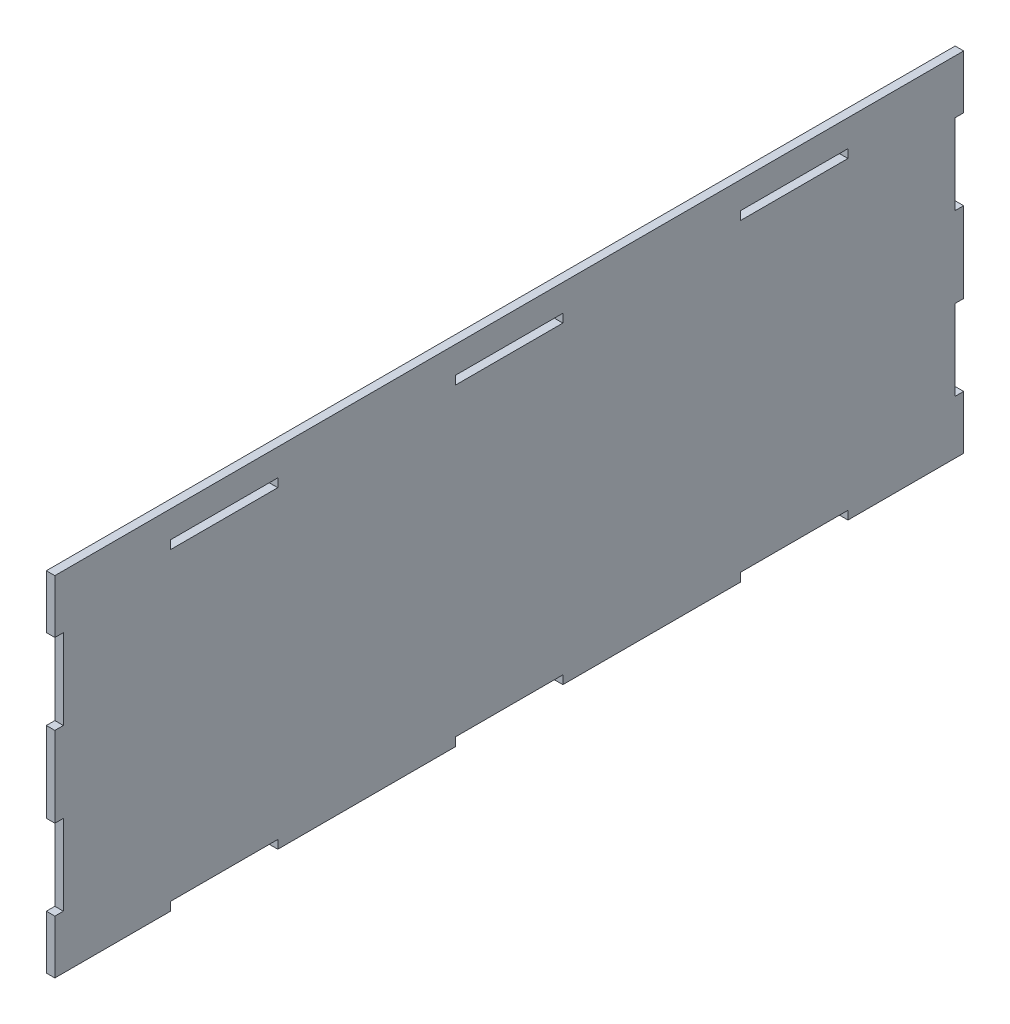
from build123d import *

# Parameters (mm, degrees)
SKETCH1_W           = 339.05
SKETCH1_H           = 130
BOSS_EXTRUDE1_DEPTH = 3.175
SKETCH2_W           = 40
SKETCH2_H           = 3.175
SKETCH2_W_2         = 3.175
SKETCH2_H_2         = 30
CUT_EXTRUDE1_DEPTH  = 10
SKETCH3_W           = 40
SKETCH3_H           = 3.175
CUT_EXTRUDE2_DEPTH  = 364.132184094
LPATTERN1_COUNT     = 3
LPATTERN1_PITCH     = 106.35


with BuildPart() as part:
    # Sketch1 → Boss-Extrude1 (new body)
    with BuildSketch(Plane(origin=(0, 0, 0), x_dir=(0, 0, -1), z_dir=(1, 0, 0))):
        with Locations((169.525, -65)):
            Rectangle(SKETCH1_W, SKETCH1_H)
    extrude(amount=BOSS_EXTRUDE1_DEPTH)

    # Sketch2 → Cut-Extrude1 (cut)
    with BuildSketch(Plane(origin=(3.175, 0, 0), x_dir=(0, 0, -1), z_dir=(1, 0, 0))):
        with Locations((63.175, -11.5875)):
            Rectangle(SKETCH2_W, SKETCH2_H)
        with Locations((169.525, -11.5875)):
            Rectangle(SKETCH2_W, SKETCH2_H)
        with Locations((275.875, -11.5875)):
            Rectangle(SKETCH2_W, SKETCH2_H)
        with Locations((337.4625, -35)):
            Rectangle(SKETCH2_W_2, SKETCH2_H_2)
        with Locations((337.4625, -95)):
            Rectangle(SKETCH2_W_2, SKETCH2_H_2)
        with Locations((1.5875, -35)):
            Rectangle(SKETCH2_W_2, SKETCH2_H_2)
        with Locations((1.5875, -95)):
            Rectangle(SKETCH2_W_2, SKETCH2_H_2)
    extrude(amount=-CUT_EXTRUDE1_DEPTH, mode=Mode.SUBTRACT)

    # Sketch3 → Cut-Extrude2 (cut, through all)
    with BuildSketch(Plane(origin=(3.175, 0, 0), x_dir=(0, 0, -1), z_dir=(1, 0, 0))):
        with Locations((63.18, -128.4125)):
            Rectangle(SKETCH3_W, SKETCH3_H)
    cut_extrude2 = extrude(amount=-CUT_EXTRUDE2_DEPTH, mode=Mode.SUBTRACT)

    # LPattern1: Cut-Extrude2 ×3
    with Locations(*[(0, 0, -i * LPATTERN1_PITCH) for i in range(1, LPATTERN1_COUNT)]):
        add(cut_extrude2, mode=Mode.SUBTRACT)


solid = part.part
